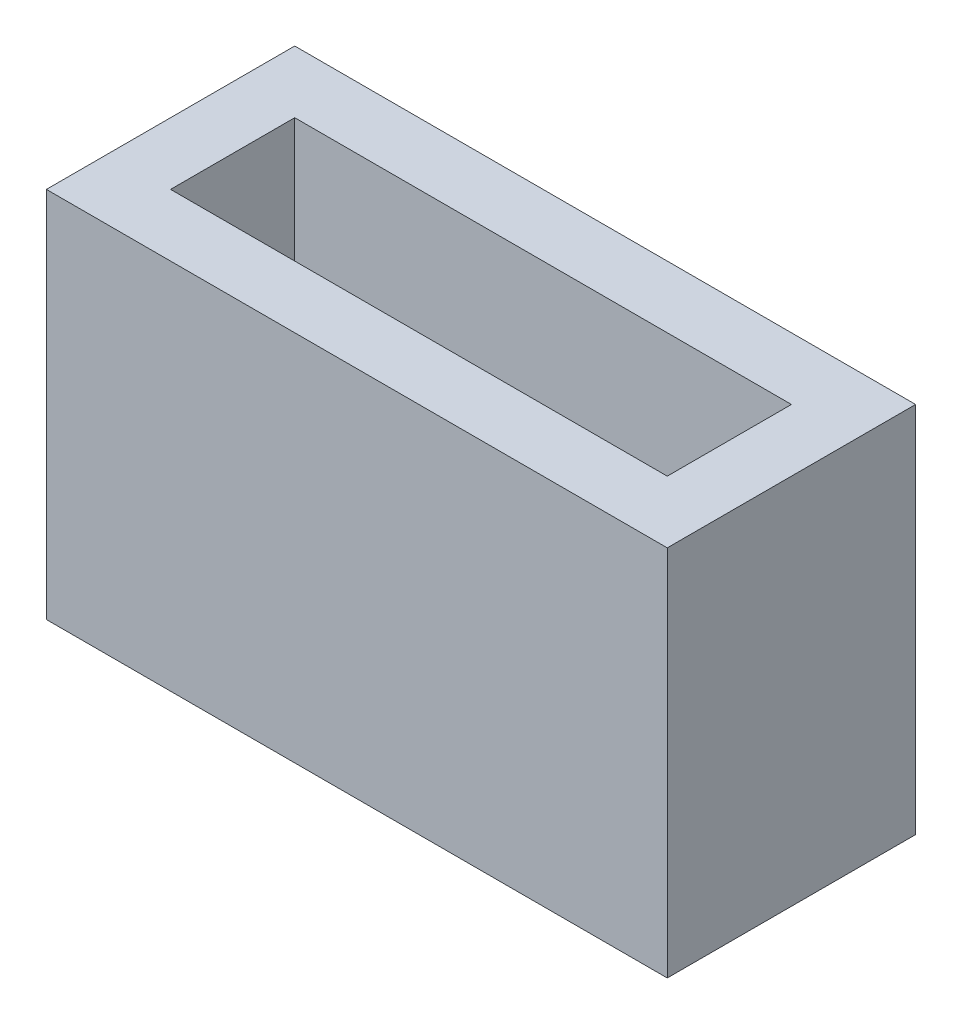
from build123d import *

# Parameters (mm, degrees)
SKETCH_2_W          = 50
SKETCH_2_H          = 20
SKETCH_2_W_2        = 40
SKETCH_2_H_2        = 10
EXTRUDE_1_DEPTH     = 30
SKETCH_3_R          = 5
CUT_EXTRUDE_1_DEPTH = 5


with BuildPart() as part:
    # 草图2 → 凸台-拉伸1 (new body)
    with BuildSketch(Plane(origin=(0, 0, 0), x_dir=(1, 0, 0), z_dir=(0, 1, 0))):
        Rectangle(SKETCH_2_W, SKETCH_2_H)
        Rectangle(SKETCH_2_W_2, SKETCH_2_H_2, mode=Mode.SUBTRACT)
    extrude(amount=EXTRUDE_1_DEPTH)

    # 草图3 → 切除-拉伸1 (cut)
    with BuildSketch(Plane(origin=(0, 0, -10), x_dir=(-1, 0, 0), z_dir=(0, 0, -1))):
        with Locations((0, 15)):
            Circle(SKETCH_3_R)
    extrude(amount=-CUT_EXTRUDE_1_DEPTH, mode=Mode.SUBTRACT)


solid = part.part
